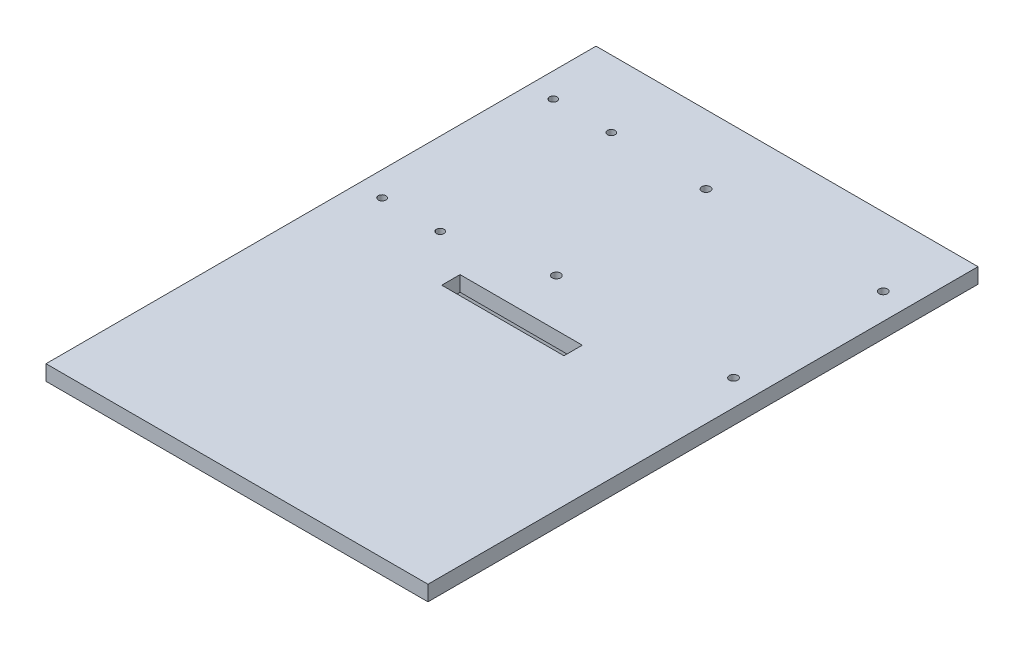
from build123d import *

# Parameters (mm, degrees)
ESQUISSE1_W                  = 62
ESQUISSE1_H                  = 12
ESQUISSE1_W_2                = 58
ESQUISSE1_H_2                = 8
BOSS_EXTRU_1_DEPTH           = 15
ESQUISSE2_R                  = 3.175
ENL_V_MAT_EXTRU_1_DEPTH      = 37.469165058
ESQUISSE3_W                  = 125
ESQUISSE3_H                  = 180
BOSS_EXTRU_2_DEPTH           = 5
ENL_V_MAT_EXTRU_3_REACH      = 112.595
ESQUISSE6_W                  = 40
ESQUISSE6_H                  = 6
ENL_V_MAT_EXTRU_4_DEPTH      = 112.38334705
ENL_V_MAT_EXTRU_4_DEPTH_BACK = 112.38334705
ESQUISSE8_R                  = 1.375
ENL_V_MAT_EXTRU_5_DEPTH      = 112.38334705
ENL_V_MAT_EXTRU_5_DEPTH_BACK = 112.38334705
ESQUISSE9_R                  = 1.25


with BuildPart() as part:
    # Esquisse1 → Boss.-Extru.1 (new body)
    with BuildSketch(Plane(origin=(0, 0, 0), x_dir=(1, 0, 0), z_dir=(0, 1, 0))):
        Rectangle(ESQUISSE1_W, ESQUISSE1_H)
        Rectangle(ESQUISSE1_W_2, ESQUISSE1_H_2, mode=Mode.SUBTRACT)
    extrude(amount=BOSS_EXTRU_1_DEPTH)

    # Esquisse2 → Enlèv. mat.-Extru.1 (cut, through all)
    with BuildSketch(Plane.XY.offset(6)):
        with Locations((0, 9)):
            Circle(ESQUISSE2_R)
    extrude(amount=-ENL_V_MAT_EXTRU_1_DEPTH, mode=Mode.SUBTRACT)

    # Esquisse3 → Boss.-Extru.2 (add)
    with BuildSketch(Plane(origin=(0, 15, 0), x_dir=(1, 0, 0), z_dir=(0, 1, 0))):
        Rectangle(ESQUISSE3_W, ESQUISSE3_H)
    extrude(amount=BOSS_EXTRU_2_DEPTH)

    # Esquisse6 → Enlèv. mat.-Extru.3 (cut, up to next)
    with BuildSketch(Plane(origin=(0, 15, 0), x_dir=(-1, 0, 0), z_dir=(0, -1, 0)), mode=Mode.PRIVATE) as enl_v_mat_extru_3_sk1:
        Rectangle(ESQUISSE6_W, ESQUISSE6_H)
    enl_v_mat_extru_3_tool1 = extrude(enl_v_mat_extru_3_sk1.sketch, amount=-ENL_V_MAT_EXTRU_3_REACH, mode=Mode.PRIVATE) & part.part
    add(enl_v_mat_extru_3_tool1.solids().sort_by_distance((0, 15, 0))[0], mode=Mode.SUBTRACT)

    # Esquisse8 → Enlèv. mat.-Extru.4 (cut, two sides: drawn at the far end of the back side and taken through both)
    with BuildSketch(Plane(origin=(0, 20, 0), x_dir=(1, 0, 0), z_dir=(0, 1, 0)).offset(-ENL_V_MAT_EXTRU_4_DEPTH_BACK)):
        with Locations(Location((54, 67.5, 0), (0, 0, 270))):
            Circle(ESQUISSE8_R)
        with Locations(Location((54, 18.5, 0), (0, 0, 270))):
            Circle(ESQUISSE8_R)
        with Locations(Location((-4, 67.5, 0), (0, 0, 270))):
            Circle(ESQUISSE8_R)
        with Locations(Location((-4, 18.5, 0), (0, 0, 270))):
            Circle(ESQUISSE8_R)
    extrude(amount=ENL_V_MAT_EXTRU_4_DEPTH + ENL_V_MAT_EXTRU_4_DEPTH_BACK, mode=Mode.SUBTRACT)

    # Esquisse9 → Enlèv. mat.-Extru.5 (cut, two sides: drawn at the far end of the back side and taken through both)
    with BuildSketch(Plane(origin=(0, 20, 0), x_dir=(1, 0, 0), z_dir=(0, 1, 0)).offset(-ENL_V_MAT_EXTRU_5_DEPTH_BACK)):
        with Locations(Location((-35.5, 68, 0), (0, 0, 270))):
            Circle(ESQUISSE9_R)
        with Locations(Location((-54.5, 68, 0), (0, 0, 270))):
            Circle(ESQUISSE9_R)
        with Locations(Location((-35.5, 12, 0), (0, 0, 270))):
            Circle(ESQUISSE9_R)
        with Locations(Location((-54.5, 12, 0), (0, 0, 270))):
            Circle(ESQUISSE9_R)
    extrude(amount=ENL_V_MAT_EXTRU_5_DEPTH + ENL_V_MAT_EXTRU_5_DEPTH_BACK, mode=Mode.SUBTRACT)


solid = part.part
